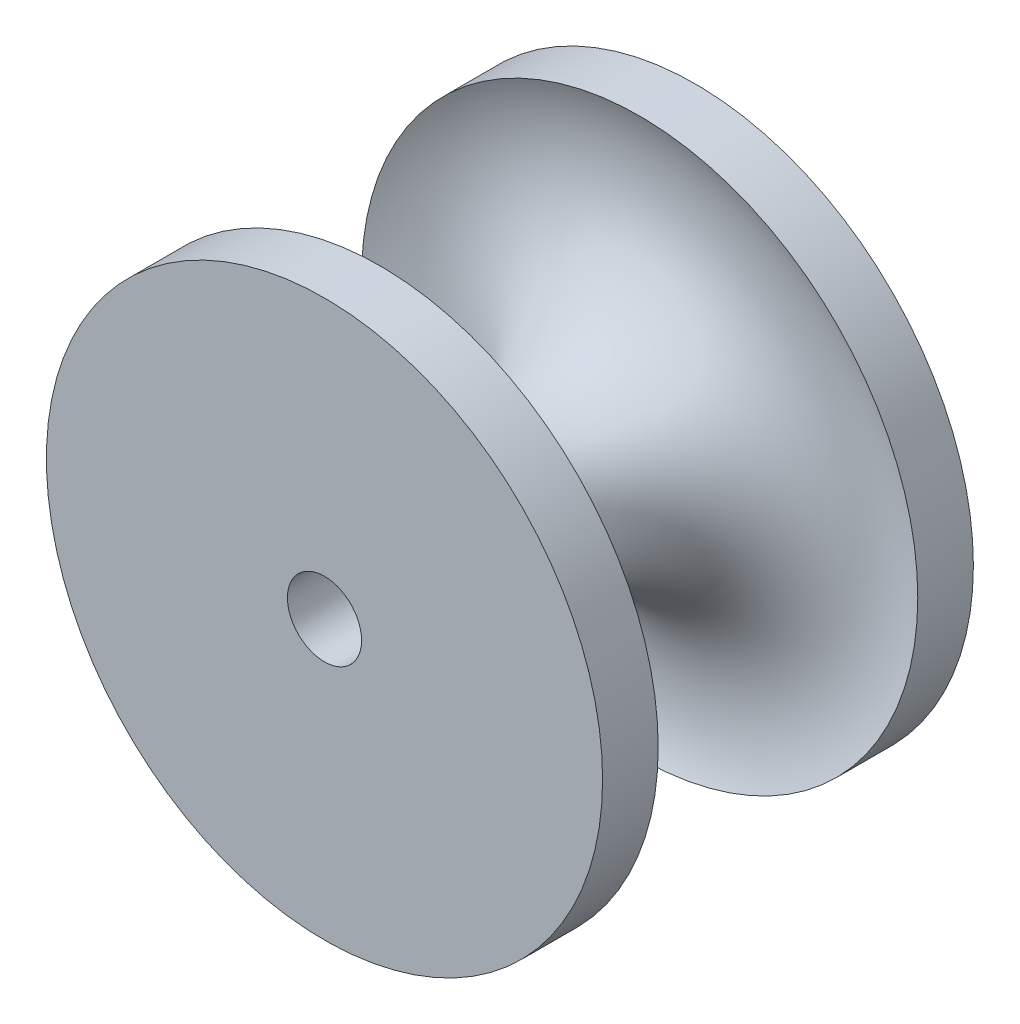
from build123d import *

# Parameters (mm, degrees)
SKETCH1_R               = 19.05
BOSS_EXTRUDE1_DEPTH     = 25.4
CUT_EXTRUDE1_DEPTH      = 36.83
CUT_EXTRUDE1_DEPTH_BACK = 7.366
SKETCH3_R               = 2.54


with BuildPart() as part:
    # Sketch1 → Boss-Extrude1 (new body)
    with BuildSketch(Plane.XY):
        Circle(SKETCH1_R)
    extrude(amount=BOSS_EXTRUDE1_DEPTH)

    # Sketch2 → Cut-Revolve1 (revolve, cut)
    with BuildSketch(Plane(origin=(0, 0, 0), x_dir=(0, 0, -1), z_dir=(1, 0, 0)), mode=Mode.PRIVATE) as cut_revolve1_sk:
        with BuildLine():
            Line((-3.81, 19.05), (-21.59, 19.05))
            ThreePointArc((-21.59, 19.05), (-12.7, 5.130913707), (-3.81, 19.05))
        make_face()
    revolve(cut_revolve1_sk.sketch.rotate(Axis((0, 0, 36.401990555), (0, 0, -1)), 90), axis=Axis((0, 0, 36.401990555), (0, 0, -1)), mode=Mode.SUBTRACT)

    # Sketch3 → Cut-Extrude1 (cut, two sides: drawn at the far end of the back side and taken through both)
    with BuildSketch(Plane.XY.offset(-CUT_EXTRUDE1_DEPTH_BACK)):
        Circle(SKETCH3_R)
    extrude(amount=CUT_EXTRUDE1_DEPTH + CUT_EXTRUDE1_DEPTH_BACK, mode=Mode.SUBTRACT)


solid = part.part
